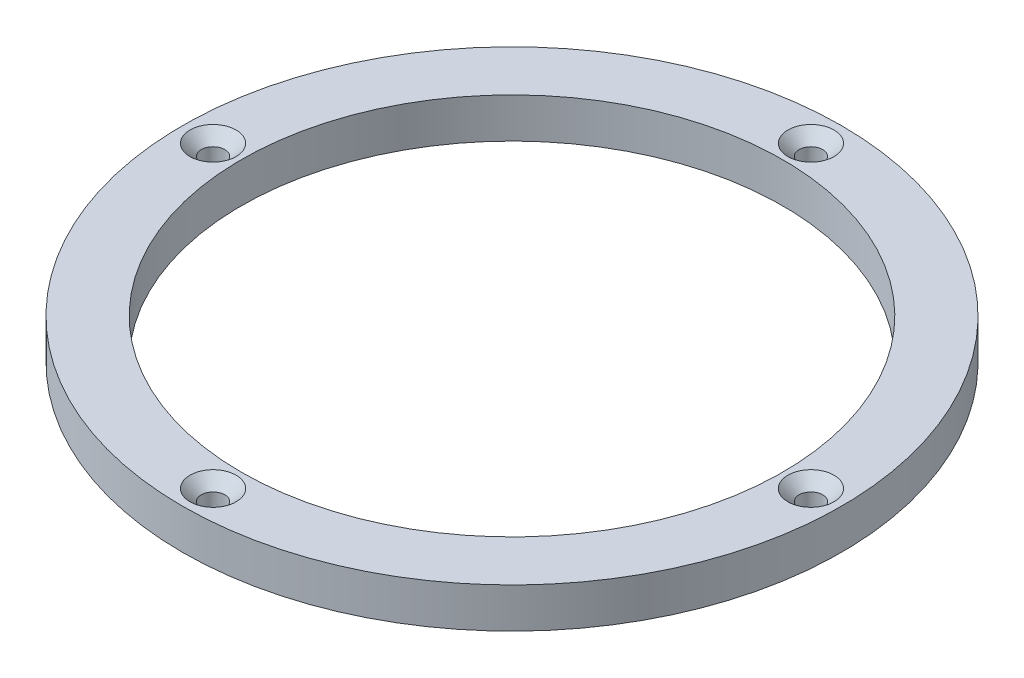
from build123d import *

# Parameters (mm, degrees)
SKETCH_1_R               = 70
SKETCH_1_R_2             = 2.5
SKETCH_1_R_3             = 57.5
EXTRUDE_1_DEPTH          = 8.5
PATTERN_CIRCULAR_1_COUNT = 4


with BuildPart() as part:
    # 草图1 → 凸台-拉伸1 (new body)
    with BuildSketch(Plane(origin=(0, 0, 0), x_dir=(1, 0, 0), z_dir=(0, 1, 0))):
        Circle(SKETCH_1_R)
        with Locations((0, -63.5)):
            Circle(SKETCH_1_R_2, mode=Mode.SUBTRACT)
        with Locations((63.5, 0)):
            Circle(SKETCH_1_R_2, mode=Mode.SUBTRACT)
        with Locations((-63.5, 0)):
            Circle(SKETCH_1_R_2, mode=Mode.SUBTRACT)
        Circle(SKETCH_1_R_3, mode=Mode.SUBTRACT)
        with Locations((0, 63.5)):
            Circle(SKETCH_1_R_2, mode=Mode.SUBTRACT)
    extrude(amount=EXTRUDE_1_DEPTH)

    # 草图2 → 切除-旋转1 (revolve, cut)
    with BuildSketch(Plane.XY.offset(-63.5)):
        Polygon((0, 8.5), (4.9, 8.5), (1.6, 5.2), (0, 5.2), align=None)
    cut_revolve_1 = revolve(axis=Axis((0, 0, -63.5), (0, 1, 0)), mode=Mode.SUBTRACT)

    # 阵列(圆周)1: 切除-旋转1 ×4 about axis
    pattern_circular_1_axis = Axis((0, 8.5, 0), (0, -1, 0))
    for i in range(1, PATTERN_CIRCULAR_1_COUNT):
        add(cut_revolve_1.rotate(pattern_circular_1_axis, i * 360 / PATTERN_CIRCULAR_1_COUNT), mode=Mode.SUBTRACT)


solid = part.part
